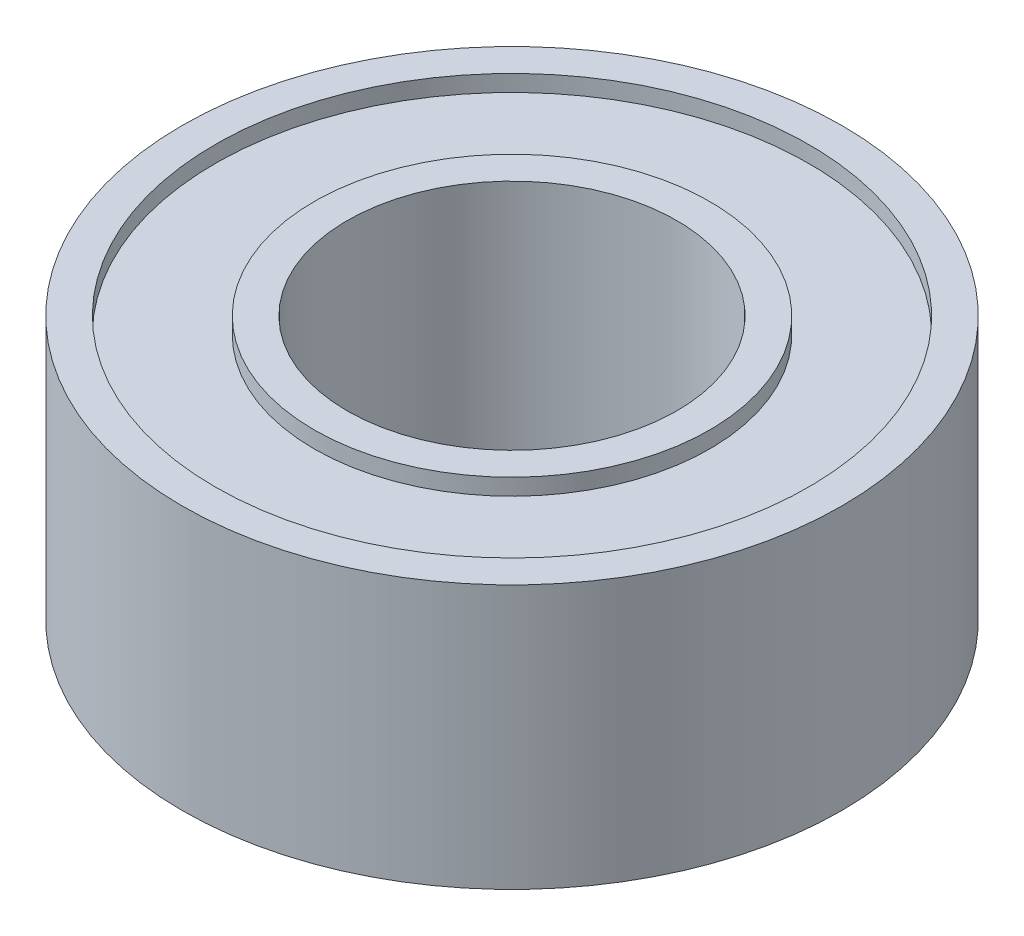
from build123d import *

# Parameters (mm, degrees)
SKETCH1_R             = 5
SKETCH1_R_2           = 4.5
BOSS_EXTRUDE1_DEPTH   = 2
SKETCH1_R_3           = 3
SKETCH1_R_4           = 2.5
BOSS_EXTRUDE1_2_DEPTH = 2
SKETCH1_3_R           = 4.5
SKETCH1_3_R_2         = 3
BOSS_EXTRUDE2_DEPTH   = 1.75


with BuildPart() as part:
    # Sketch1 → Boss-Extrude1 (new, symmetric)
    with BuildSketch(Plane(origin=(0, 0, 0), x_dir=(1, 0, 0), z_dir=(0, 1, 0))):
        Circle(SKETCH1_R)
        Circle(SKETCH1_R_2, mode=Mode.SUBTRACT)
    extrude(amount=BOSS_EXTRUDE1_DEPTH, both=True)



with BuildPart() as body_2:
    # Sketch1 → Boss-Extrude1 2 (new, symmetric)
    with BuildSketch(Plane(origin=(0, 0, 0), x_dir=(1, 0, 0), z_dir=(0, 1, 0))):
        Circle(SKETCH1_R_3)
        Circle(SKETCH1_R_4, mode=Mode.SUBTRACT)
    extrude(amount=BOSS_EXTRUDE1_2_DEPTH, both=True)


with BuildPart() as part_1:
    add(part.part)

    add(body_2.part)  # Boss-Extrude2 merges body 2
    # Sketch1<3> → Boss-Extrude2 (add, symmetric)
    with BuildSketch(Plane(origin=(0, 0, 0), x_dir=(1, 0, 0), z_dir=(0, 1, 0))):
        Circle(SKETCH1_3_R)
        Circle(SKETCH1_3_R_2, mode=Mode.SUBTRACT)
    extrude(amount=BOSS_EXTRUDE2_DEPTH, both=True)


solid = part_1.part
